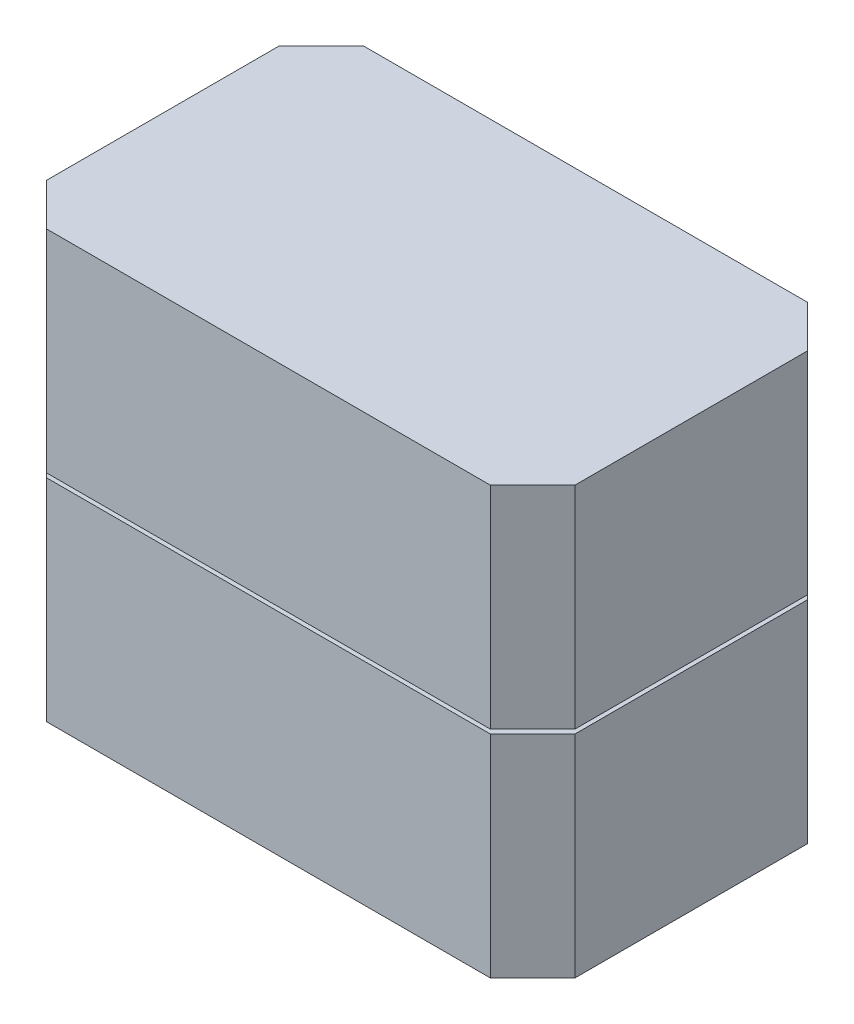
from build123d import *

# Parameters (mm, degrees)
SKETCH2_W           = 25
SKETCH2_H           = 15
SKETCH2_R           = 0.5
BOSS_EXTRUDE1_DEPTH = 5
SKETCH3_W           = 25
SKETCH3_H           = 15
SKETCH3_W_2         = 22.6
SKETCH3_H_2         = 12.6
BOSS_EXTRUDE2_DEPTH = 5
CHAMFER1_SIZE       = 1
CHAMFER2_SIZE       = 2
BOSS_EXTRUDE3_START = 1.2
SKETCH4_W           = 18
SKETCH4_H           = 2.1
SKETCH4_W_2         = 22.2
SKETCH4_H_2         = 8
SKETCH4_W_3         = 4
SKETCH4_W_4         = 6
BOSS_EXTRUDE3_DEPTH = 4
SKETCH5_W           = 8.5
SKETCH5_H           = 2.3
BOSS_EXTRUDE4_DEPTH = 8
BOSS_EXTRUDE5_DEPTH = 2


with BuildPart() as part:
    # Sketch2 → Boss-Extrude1 (new body)
    with BuildSketch(Plane(origin=(0, 0, 0), x_dir=(1, 0, 0), z_dir=(0, 1, 0))):
        Rectangle(SKETCH2_W, SKETCH2_H)
        with Locations(Location((1.6, -4.95, 0), (0, 0, 270))):
            Circle(SKETCH2_R, mode=Mode.SUBTRACT)
        with Locations(Location((0.1, -4.95, 0), (0, 0, 270))):
            Circle(SKETCH2_R, mode=Mode.SUBTRACT)
        with Locations(Location((-1.4, -4.95, 0), (0, 0, 270))):
            Circle(SKETCH2_R, mode=Mode.SUBTRACT)
        with Locations(Location((-2.9, -4.95, 0), (0, 0, 270))):
            Circle(SKETCH2_R, mode=Mode.SUBTRACT)
        with Locations(Location((-4.4, -4.95, 0), (0, 0, 270))):
            Circle(SKETCH2_R, mode=Mode.SUBTRACT)
        with Locations(Location((10, -5.75, 0), (0, 0, 270))):
            Circle(SKETCH2_R, mode=Mode.SUBTRACT)
        with Locations(Location((10, 5.75, 0), (0, 0, 270))):
            Circle(SKETCH2_R, mode=Mode.SUBTRACT)
    extrude(amount=BOSS_EXTRUDE1_DEPTH)

    # Sketch3 → Boss-Extrude2 (add)
    with BuildSketch(Plane(origin=(0, 5, 0), x_dir=(1, 0, 0), z_dir=(0, 1, 0))):
        Rectangle(SKETCH3_W, SKETCH3_H)
        Rectangle(SKETCH3_W_2, SKETCH3_H_2, mode=Mode.SUBTRACT)
    extrude(amount=BOSS_EXTRUDE2_DEPTH)

    # Chamfer1
    chamfer1_edges = [part.edges().sort_by_distance(p)[0] for p in [
        (11.3, 7.5, 6.3),
        (11.3, 7.5, -6.3),
        (-11.3, 7.5, -6.3),
        (-11.3, 7.5, 6.3),
    ]]
    chamfer(chamfer1_edges, length=CHAMFER1_SIZE)

    # Chamfer2
    chamfer2_edges = [part.edges().sort_by_distance(p)[0] for p in [
        (12.5, 5, 7.5),
        (-12.5, 5, 7.5),
        (-12.5, 5, -7.5),
        (12.5, 5, -7.5),
    ]]
    chamfer(chamfer2_edges, length=CHAMFER2_SIZE)


with BuildPart() as body_2:
    # Sketch4 → Boss-Extrude3 (new body)
    with BuildSketch(Plane(origin=(0, 5, 0), x_dir=(1, 0, 0), z_dir=(0, 1, 0)).offset(BOSS_EXTRUDE3_START)):
        with Locations((0, 5.05)):
            Rectangle(SKETCH4_W, SKETCH4_H)
        Rectangle(SKETCH4_W_2, SKETCH4_H_2)
        with Locations((-7.5, -5.05)):
            Rectangle(SKETCH4_W_3, SKETCH4_H)
        with Locations((6, -5.05)):
            Rectangle(SKETCH4_W_4, SKETCH4_H)
    extrude(amount=BOSS_EXTRUDE3_DEPTH)

    # Sketch5 → Boss-Extrude4 (add)
    with BuildSketch(Plane(origin=(0, 10.2, 0), x_dir=(1, 0, 0), z_dir=(0, 1, 0))):
        Polygon((12.5, -5.5), (12.5, 5.5), (10.5, 7.5), (-10.5, 7.5), (-12.5, 5.5), (-12.5, -5.5), (-10.5, -7.5), (10.5, -7.5), align=None)
        Polygon((9, 4), (9, 6.3), (10.3, 6.3), (11.3, 5.3), (11.3, 4), align=None, mode=Mode.SUBTRACT)
        Polygon((9, -4), (11.3, -4), (11.3, -5.3), (10.3, -6.3), (9, -6.3), align=None, mode=Mode.SUBTRACT)
        with Locations((-1.25, -5.15)):
            Rectangle(SKETCH5_W, SKETCH5_H, mode=Mode.SUBTRACT)
    extrude(amount=BOSS_EXTRUDE4_DEPTH)

    # Sketch6 → Boss-Extrude5 (add)
    with BuildSketch(Plane(origin=(0, 18.2, 0), x_dir=(1, 0, 0), z_dir=(0, 1, 0))):
        Polygon((10.5, -7.5), (12.5, -5.5), (12.5, 5.5), (10.5, 7.5), (-10.5, 7.5), (-12.5, 5.5), (-12.5, -5.5), (-10.5, -7.5), align=None)
    extrude(amount=BOSS_EXTRUDE5_DEPTH)


solid = Compound([part.part, body_2.part])
